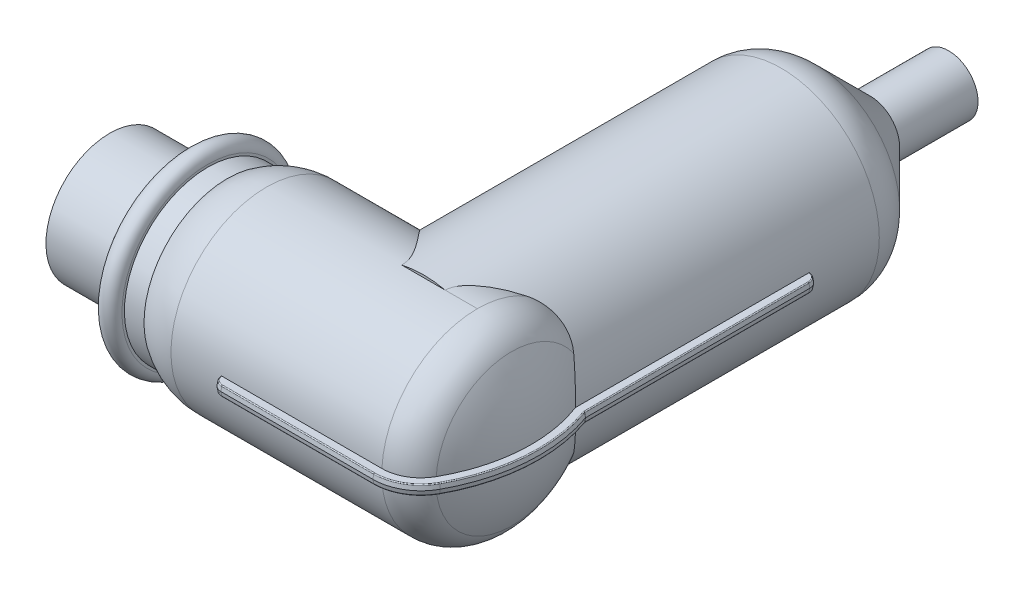
from build123d import *

# Parameters (mm, degrees)
BOSS_EXTRUDE1_DEPTH                     = 0.5
BOSS_EXTRUDE1_DRAFT                     = 10.000000000000048
BOSS_EXTRUDE1_PROFILE_2_DEPTH           = 0.5
BOSS_EXTRUDE1_PROFILE_2_DRAFT           = 10.000000000000048
BOSS_EXTRUDE1_OTHER_WAY_DEPTH           = 0.5
BOSS_EXTRUDE1_OTHER_WAY_DRAFT           = -10.000000000000048
BOSS_EXTRUDE1_OTHER_WAY_PROFILE_2_DEPTH = 0.5
BOSS_EXTRUDE1_OTHER_WAY_PROFILE_2_DRAFT = -10.000000000000048
FILLET1_R                               = 0.1


with BuildPart() as part:
    # Sketch1 → Revolve1 (revolve)
    with BuildSketch(Plane.XY):
        with BuildLine():
            Line((8, 6.500000000000001), (8, 8.750000000000002))
            ThreePointArc((8, 8.750000000000002), (9.000000000000002, 9.750000000000004), (9.999999999999998, 8.750000000000002))
            Line((9.999999999999998, 8.750000000000002), (10, 8.500000000000002))
            Line((10, 8.500000000000002), (12, 8.500000000000002))
            ThreePointArc((12, 8.500000000000002), (13.904618173219975, 9.430221845696087), (16, 9.750000000000002))
            Line((16, 9.750000000000002), (37.5, 9.750000000000005))
            ThreePointArc((37.5, 9.750000000000005), (39.52287799884967, 9.20079188039064), (40.99026548672565, 7.703982300884974))
            ThreePointArc((40.99026548672565, 7.703982300884974), (42.489297400091885, 3.9809036695891984), (43, -1.85e-15))
            Line((43, -1.85e-15), (0, 0))
            Line((0, 0), (0, 6.5))
            Line((0, 6.5), (8, 6.500000000000001))
        make_face()
    revolve(axis=Axis((0, 0, 0), (-1, -3.6e-16, 0)))

    # Sketch2 → Revolve2 (revolve)
    with BuildSketch(Plane(origin=(0, 0, 0), x_dir=(1, 0, 0), z_dir=(0, 1, 0)), mode=Mode.PRIVATE) as revolve2_sk:
        with BuildLine():
            Line((41.99999999999976, 1.35e-15), (32, 1.2e-16))
            Line((32, 1.2e-16), (32, 53.57106781186529))
            Line((32, 53.57106781186529), (34.99999999999988, 53.57106781186529))
            Line((34.99999999999988, 53.57106781186529), (34.99999999999988, 45.57106781186529))
            Line((34.99999999999988, 45.57106781186529), (40.535533905932475, 40.03553390593276))
            ThreePointArc((40.535533905932475, 40.03553390593276), (41.61939766255619, 38.413417161825464), (41.99999999999975, 36.5))
            Line((41.99999999999975, 36.5), (41.99999999999976, 1.35e-15))
        make_face()
    revolve(revolve2_sk.sketch.rotate(Axis((32, 0, -1.2e-16), (3.9e-16, 0, 1)), 180), axis=Axis((32, 0, -1.2e-16), (3.9e-16, 0, 1)))


with BuildPart() as boss_extrude1_tool:
    # Sketch3 → Boss-Extrude1 (with draft: the straight prism first)
    with BuildSketch(Plane(origin=(0, 0, 0), x_dir=(1, 0, 0), z_dir=(0, 1, 0))):
        with BuildLine():
            ThreePointArc((41.9, 5.461213463604948), (42.823153569307244, -1.184192964034375), (40.92312334535289, -7.618749999999999))
            ThreePointArc((40.92312334535289, -7.618749999999999), (39.49021041601133, -9.10396220908942), (37.49999999999999, -9.649999999999999))
            Line((37.49999999999999, -9.649999999999999), (21.000000000000004, -9.65))
            ThreePointArc((21.000000000000004, -9.65), (21.292893218813457, -10.357106781186548), (22.000000000000007, -10.650000000000002))
            Line((22.000000000000007, -10.650000000000002), (37.49999999999999, -10.65))
            ThreePointArc((37.49999999999999, -10.65), (40.000520779091154, -9.96395251911235), (41.80084728005876, -8.097916666666663))
            ThreePointArc((41.80084728005876, -8.097916666666663), (43.813444664506, -1.3482732099796026), (42.9, 5.635554814046178))
            Line((42.9, 5.635554814046178), (42.9, 28.499999999999982))
            ThreePointArc((42.9, 28.499999999999982), (42.607106781186545, 29.20710678118653), (41.9, 29.499999999999986))
            Line((41.9, 29.499999999999986), (41.9, 5.461213463604948))
        make_face()
    extrude(amount=BOSS_EXTRUDE1_DEPTH)
    # Boss-Extrude1: the draft: its side faces are tilted about the plane it starts from
    boss_extrude1_sides = [boss_extrude1_tool.faces().sort_by_distance(p)[0] for p in [
        (41.9, 0.25, -17.480606732),
        (42.823153569, 0.25, 1.184192964),
        (39.490210416, 0.25, 9.103962209),
        (29.25, 0.25, 9.65),
        (21.292893219, 0.25, 10.357106781),
        (29.75, 0.25, 10.65),
        (40.000520779, 0.25, 9.963952519),
        (43.813444665, 0.25, 1.34827321),
        (42.9, 0.25, -17.067777407),
        (42.607106781, 0.25, -29.207106781),
    ]]
    draft(boss_extrude1_sides, Plane(origin=(0, 0, 0), x_dir=(1, 0, 0), z_dir=(0, 1, 0)), BOSS_EXTRUDE1_DRAFT)


with BuildPart() as part_1:
    add(part.part)

    # Boss-Extrude1: add boss_extrude1_tool
    add(boss_extrude1_tool.part)


with BuildPart() as boss_extrude1_profile_2_tool:
    # Sketch3 → Boss-Extrude1 profile 2 (with draft: the straight prism first)
    with BuildSketch(Plane(origin=(0, 0, 0), x_dir=(1, 0, 0), z_dir=(0, 1, 0))):
        with BuildLine():
            Line((22.100000000000005, 9.649999999999999), (22.1, 29.499999999999986))
            ThreePointArc((22.1, 29.499999999999986), (21.392893218813455, 29.207106781186532), (21.1, 28.499999999999982))
            Line((21.1, 28.499999999999982), (21.100000000000005, 10.65))
            Line((21.100000000000005, 10.65), (19.000000000000004, 10.65))
            ThreePointArc((19.000000000000004, 10.65), (18.292893218813454, 10.357106781186546), (18.000000000000004, 9.649999999999997))
            Line((18.000000000000004, 9.649999999999997), (22.100000000000005, 9.649999999999999))
        make_face()
    extrude(amount=BOSS_EXTRUDE1_PROFILE_2_DEPTH)
    # Boss-Extrude1 profile 2: the draft: its side faces are tilted about the plane it starts from
    boss_extrude1_profile_2_sides = [boss_extrude1_profile_2_tool.faces().sort_by_distance(p)[0] for p in [
        (22.1, 0.25, -19.575),
        (21.392893219, 0.25, -29.207106781),
        (21.1, 0.25, -19.575),
        (20.05, 0.25, -10.65),
        (18.292893219, 0.25, -10.357106781),
        (20.05, 0.25, -9.65),
    ]]
    draft(boss_extrude1_profile_2_sides, Plane(origin=(0, 0, 0), x_dir=(1, 0, 0), z_dir=(0, 1, 0)), BOSS_EXTRUDE1_PROFILE_2_DRAFT)


with BuildPart() as part_2:
    add(part_1.part)

    # Boss-Extrude1 profile 2: add boss_extrude1_profile_2_tool
    add(boss_extrude1_profile_2_tool.part)


with BuildPart() as boss_extrude1_other_way_tool:
    # Sketch3 → Boss-Extrude1 other way (with draft: the straight prism first)
    with BuildSketch(Plane(origin=(0, 0, 0), x_dir=(1, 0, 0), z_dir=(0, 1, 0))):
        with BuildLine():
            ThreePointArc((41.9, 5.461213463604948), (42.823153569307244, -1.184192964034375), (40.92312334535289, -7.618749999999999))
            ThreePointArc((40.92312334535289, -7.618749999999999), (39.49021041601133, -9.10396220908942), (37.49999999999999, -9.649999999999999))
            Line((37.49999999999999, -9.649999999999999), (21.000000000000004, -9.65))
            ThreePointArc((21.000000000000004, -9.65), (21.292893218813457, -10.357106781186548), (22.000000000000007, -10.650000000000002))
            Line((22.000000000000007, -10.650000000000002), (37.49999999999999, -10.65))
            ThreePointArc((37.49999999999999, -10.65), (40.000520779091154, -9.96395251911235), (41.80084728005876, -8.097916666666663))
            ThreePointArc((41.80084728005876, -8.097916666666663), (43.813444664506, -1.3482732099796026), (42.9, 5.635554814046178))
            Line((42.9, 5.635554814046178), (42.9, 28.499999999999982))
            ThreePointArc((42.9, 28.499999999999982), (42.607106781186545, 29.20710678118653), (41.9, 29.499999999999986))
            Line((41.9, 29.499999999999986), (41.9, 5.461213463604948))
        make_face()
    extrude(amount=-BOSS_EXTRUDE1_OTHER_WAY_DEPTH)
    # Boss-Extrude1 other way: the draft: its side faces are tilted about the plane it starts from
    boss_extrude1_other_way_sides = [boss_extrude1_other_way_tool.faces().sort_by_distance(p)[0] for p in [
        (41.9, -0.25, -17.480606732),
        (42.823153569, -0.25, 1.184192964),
        (39.490210416, -0.25, 9.103962209),
        (29.25, -0.25, 9.65),
        (21.292893219, -0.25, 10.357106781),
        (29.75, -0.25, 10.65),
        (40.000520779, -0.25, 9.963952519),
        (43.813444665, -0.25, 1.34827321),
        (42.9, -0.25, -17.067777407),
        (42.607106781, -0.25, -29.207106781),
    ]]
    draft(boss_extrude1_other_way_sides, Plane(origin=(0, 0, 0), x_dir=(1, 0, 0), z_dir=(0, 1, 0)), BOSS_EXTRUDE1_OTHER_WAY_DRAFT)


with BuildPart() as part_3:
    add(part_2.part)

    # Boss-Extrude1 other way: add boss_extrude1_other_way_tool
    add(boss_extrude1_other_way_tool.part)


with BuildPart() as boss_extrude1_other_way_profile_2_tool:
    # Sketch3 → Boss-Extrude1 other way profile 2 (with draft: the straight prism first)
    with BuildSketch(Plane(origin=(0, 0, 0), x_dir=(1, 0, 0), z_dir=(0, 1, 0))):
        with BuildLine():
            Line((22.100000000000005, 9.649999999999999), (22.1, 29.499999999999986))
            ThreePointArc((22.1, 29.499999999999986), (21.392893218813455, 29.207106781186532), (21.1, 28.499999999999982))
            Line((21.1, 28.499999999999982), (21.100000000000005, 10.65))
            Line((21.100000000000005, 10.65), (19.000000000000004, 10.65))
            ThreePointArc((19.000000000000004, 10.65), (18.292893218813454, 10.357106781186546), (18.000000000000004, 9.649999999999997))
            Line((18.000000000000004, 9.649999999999997), (22.100000000000005, 9.649999999999999))
        make_face()
    extrude(amount=-BOSS_EXTRUDE1_OTHER_WAY_PROFILE_2_DEPTH)
    # Boss-Extrude1 other way profile 2: the draft: its side faces are tilted about the plane it starts from
    boss_extrude1_other_way_profile_2_sides = [boss_extrude1_other_way_profile_2_tool.faces().sort_by_distance(p)[0] for p in [
        (22.1, -0.25, -19.575),
        (21.392893219, -0.25, -29.207106781),
        (21.1, -0.25, -19.575),
        (20.05, -0.25, -10.65),
        (18.292893219, -0.25, -10.357106781),
        (20.05, -0.25, -9.65),
    ]]
    draft(boss_extrude1_other_way_profile_2_sides, Plane(origin=(0, 0, 0), x_dir=(1, 0, 0), z_dir=(0, 1, 0)), BOSS_EXTRUDE1_OTHER_WAY_PROFILE_2_DRAFT)


with BuildPart() as part_4:
    add(part_3.part)

    # Boss-Extrude1 other way profile 2: add boss_extrude1_other_way_profile_2_tool
    add(boss_extrude1_other_way_profile_2_tool.part)

    # Fillet1
    fillet1_edges = [part_4.edges().sort_by_distance(p)[0] for p in [
        (21.424782809147395, 0.5, -29.112803039728156),
        (21.424782809147395, -0.5, -29.112803039728156),
        (21.18816349035424, 0.5, -19.530918254822872),
        (21.188163490354235, -0.5, -19.530918254822872),
        (18.38719696027183, -0.5, -10.325217190852605),
        (20.09408174517712, 0.5, -10.561836509645767),
        (42.5752171908526, 0.5, -29.112803039728156),
        (21.38719696027183, 0.5, 10.325217190852607),
        (29.75, 0.5, 10.561836509645769),
        (39.9555300363181, 0.5, 9.888132771709909),
        (42.5752171908526, -0.5, -29.112803039728156),
        (43.72616337605166, -0.5, 1.333706731099377),
        (39.9555300363181, -0.5, 9.888132771709909),
        (29.75, -0.5, 10.561836509645767),
        (42.855918228415064, -0.2500001497661799, -5.627983327957705),
        (42.85591822841508, 0.25000014976612306, -5.627983327957643),
        (20.09408174517712, -0.5, -10.561836509645765),
        (21.14408174517712, -0.24999999999999978, -10.605918254822882),
        (21.14408174517712, 0.25, -10.605918254822882),
        (18.38719696027183, 0.5, -10.325217190852605),
        (42.811836509645765, 0.5, -17.060200825546012),
        (43.72616337605165, 0.5, 1.3337067310994082),
        (42.81183650964576, -0.5, -17.060200825546048),
        (21.38719696027183, -0.5, 10.325217190852607),
    ]]
    fillet(fillet1_edges, radius=FILLET1_R)


solid = part_4.part
